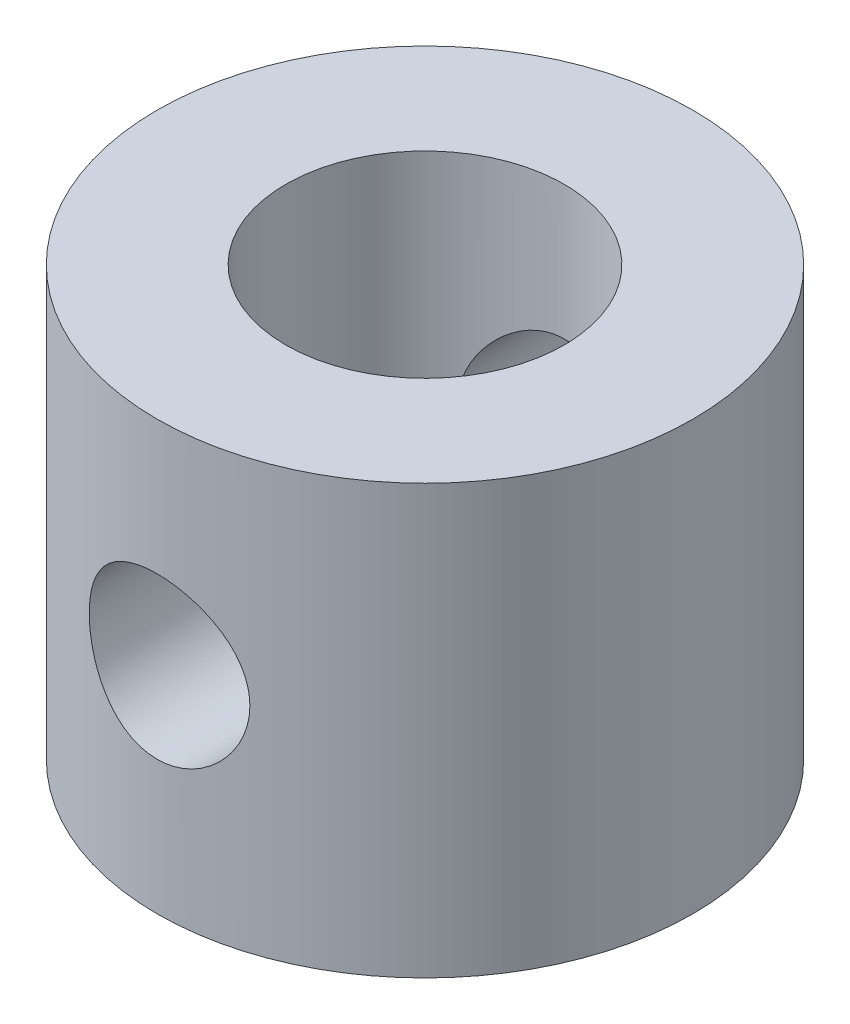
from build123d import *

# Parameters (mm, degrees)
SKETCH1_R           = 5
BOSS_EXTRUDE1_DEPTH = 8
SKETCH2_R           = 2.6
CUT_EXTRUDE1_DEPTH  = 20
SKETCH3_R           = 1.5
CUT_EXTRUDE2_DEPTH  = 20


with BuildPart() as part:
    # Sketch1 → Boss-Extrude1 (new body)
    with BuildSketch(Plane(origin=(0, 0, 0), x_dir=(1, 0, 0), z_dir=(0, 1, 0))):
        with Locations(Location((0, 0, 0), (0, 0, 270))):
            Circle(SKETCH1_R)
    extrude(amount=BOSS_EXTRUDE1_DEPTH)

    # Sketch2 → Cut-Extrude1 (cut, symmetric)
    with BuildSketch(Plane(origin=(0, 0, 0), x_dir=(1, 0, 0), z_dir=(0, 1, 0))):
        with Locations(Location((0, 0, 0), (0, 0, 270))):
            Circle(SKETCH2_R)
    extrude(amount=CUT_EXTRUDE1_DEPTH, both=True, mode=Mode.SUBTRACT)

    # Sketch3 → Cut-Extrude2 (cut, symmetric)
    with BuildSketch(Plane.XY):
        with Locations((0, 4)):
            Circle(SKETCH3_R)
    extrude(amount=CUT_EXTRUDE2_DEPTH, both=True, mode=Mode.SUBTRACT)


solid = part.part
